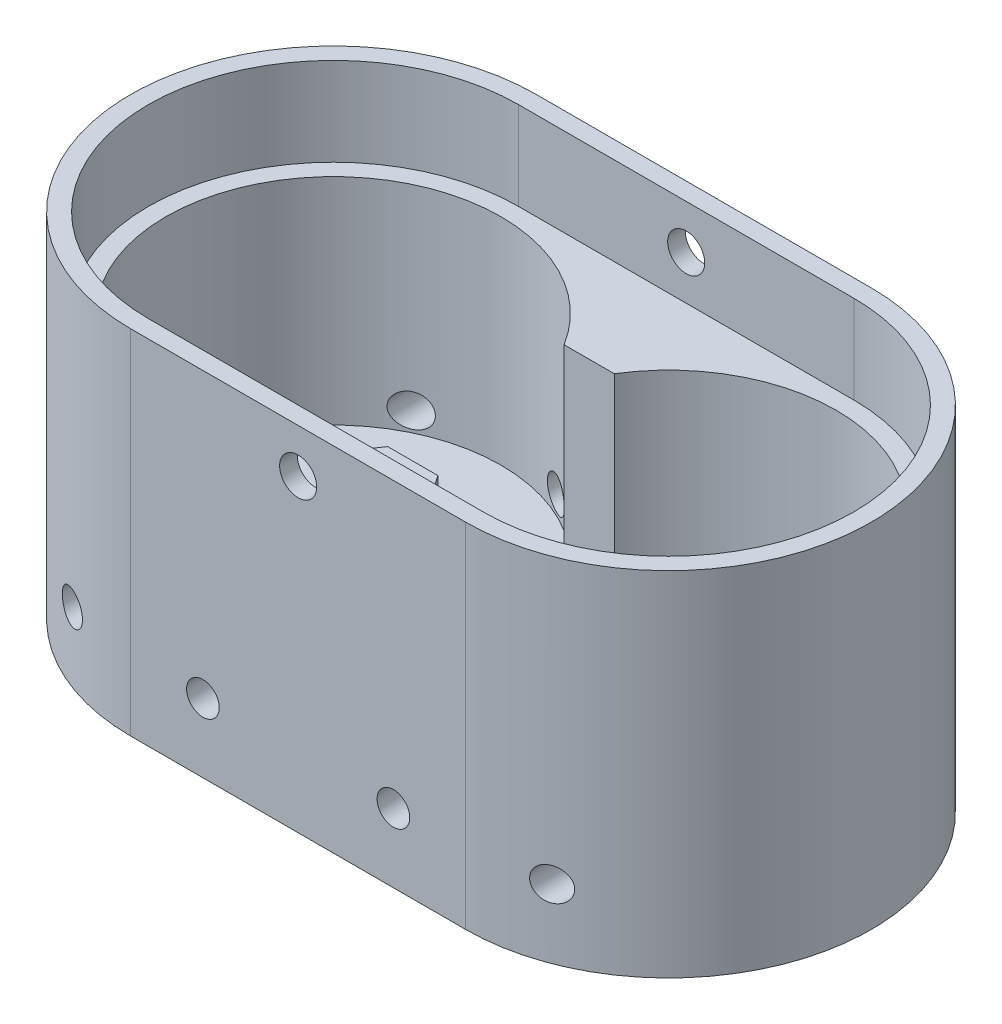
from build123d import *

# Parameters (mm, degrees)
BOSS_EXTRUDE1_DEPTH = 2
BOSS_EXTRUDE2_DEPTH = 13
BOSS_EXTRUDE3_DEPTH = 5
SKETCH8_R           = 1.5
CUT_EXTRUDE3_DEPTH  = 30.954131602
SKETCH10_W          = 12.2
SKETCH10_H          = 12.2
BOSS_EXTRUDE4_DEPTH = 0.8
SKETCH11_R          = 0.925
CUT_EXTRUDE4_DEPTH  = 38.013511047
SKETCH12_R          = 1.05
CUT_EXTRUDE5_DEPTH  = 38.01351122


with BuildPart() as part:
    # Sketch1 → Boss-Extrude1 (new body)
    with BuildSketch(Plane(origin=(0, 0, 0), x_dir=(1, 0, 0), z_dir=(0, 1, 0))):
        with BuildLine():
            Line((-9.5, 11.5), (9.5, 11.5))
            ThreePointArc((9.5, 11.5), (21, 0), (9.5, -11.5))
            Line((9.5, -11.5), (-9.5, -11.5))
            ThreePointArc((-9.5, -11.5), (-21, 0), (-9.5, 11.5))
        make_face()
    extrude(amount=BOSS_EXTRUDE1_DEPTH)

    # Sketch2 → Boss-Extrude2 (add)
    with BuildSketch(Plane(origin=(0, 2, 0), x_dir=(1, 0, 0), z_dir=(0, 1, 0))):
        with BuildLine():
            ThreePointArc((-9.5, 11.5), (-21, 0), (-9.5, -11.5))
            Line((-9.5, -11.5), (9.5, -11.5))
            ThreePointArc((9.5, -11.5), (21, 0), (9.5, 11.5))
            Line((9.5, 11.5), (-9.5, 11.5))
        make_face()
        with BuildLine():
            ThreePointArc((-9.5, 9.5), (-4.876689498, 8.299096336), (-1.422252789, 5))
            Line((-1.422252789, 5), (1.422252789, 5))
            ThreePointArc((1.422252789, 5), (4.876689498, 8.299096336), (9.5, 9.5))
            ThreePointArc((9.5, 9.5), (19, 0), (9.5, -9.5))
            ThreePointArc((9.5, -9.5), (4.876689498, -8.299096336), (1.422252789, -5))
            Line((1.422252789, -5), (-1.422252789, -5))
            ThreePointArc((-1.422252789, -5), (-4.876689498, -8.299096336), (-9.5, -9.5))
            ThreePointArc((-9.5, -9.5), (-19, 0), (-9.5, 9.5))
        make_face(mode=Mode.SUBTRACT)
    extrude(amount=BOSS_EXTRUDE2_DEPTH)

    # Sketch4 → Boss-Extrude3 (add)
    with BuildSketch(Plane(origin=(0, 15, 0), x_dir=(1, 0, 0), z_dir=(0, 1, 0))):
        with BuildLine():
            Line((9.5, 11.5), (-9.5, 11.5))
            ThreePointArc((-9.5, 11.5), (-21, 0), (-9.5, -11.5))
            Line((-9.5, -11.5), (9.5, -11.5))
            ThreePointArc((9.5, -11.5), (21, 0), (9.5, 11.5))
        make_face()
        with BuildLine():
            Line((9.5, 10.5), (-9.5, 10.5))
            ThreePointArc((-9.5, 10.5), (-20, 0), (-9.5, -10.5))
            Line((-9.5, -10.5), (9.5, -10.5))
            ThreePointArc((9.5, -10.5), (20, 0), (9.5, 10.5))
        make_face(mode=Mode.SUBTRACT)
    extrude(amount=BOSS_EXTRUDE3_DEPTH)

    # Sketch8 → Cut-Extrude3 (cut, through all)
    with BuildSketch(Plane(origin=(0, 2, 0), x_dir=(1, 0, 0), z_dir=(0, 1, 0))):
        with Locations(Location((-9.5, 0, 0), (0, 0, 270))):
            Circle(SKETCH8_R)
        with Locations(Location((9.5, 0, 0), (0, 0, 90))):
            Circle(SKETCH8_R)
    extrude(amount=-CUT_EXTRUDE3_DEPTH, mode=Mode.SUBTRACT)

    # Sketch10 → Boss-Extrude4 (add)
    with BuildSketch(Plane(origin=(0, 2, 0), x_dir=(1, 0, 0), z_dir=(0, 1, 0))):
        with BuildLine():
            Line((-1.422252789, -5), (1.422252789, -5))
            ThreePointArc((1.422252789, -5), (19, 0), (1.422252789, 5))
            Line((1.422252789, 5), (-1.422252789, 5))
            ThreePointArc((-1.422252789, 5), (-19, 0), (-1.422252789, -5))
        make_face()
        with Locations((9.5, 0)):
            Rectangle(SKETCH10_W, SKETCH10_H, mode=Mode.SUBTRACT)
        with Locations((-9.5, 0)):
            Rectangle(SKETCH10_W, SKETCH10_H, mode=Mode.SUBTRACT)
    extrude(amount=BOSS_EXTRUDE4_DEPTH)

    # Sketch11 → Cut-Extrude4 (cut, through all)
    with BuildSketch(Plane.XY.offset(11.5)):
        with Locations((-5.4, 3.9)):
            Circle(SKETCH11_R)
        with Locations((-13.6, 3.9)):
            Circle(SKETCH11_R)
        with Locations((13.6, 3.9)):
            Circle(SKETCH11_R)
        with Locations((5.4, 3.9)):
            Circle(SKETCH11_R)
    extrude(amount=-CUT_EXTRUDE4_DEPTH, mode=Mode.SUBTRACT)

    # Sketch12 → Cut-Extrude5 (cut, through all)
    with BuildSketch(Plane.XY.offset(11.5)):
        with Locations((0, 17.5)):
            Circle(SKETCH12_R)
    extrude(amount=-CUT_EXTRUDE5_DEPTH, mode=Mode.SUBTRACT)


solid = part.part
